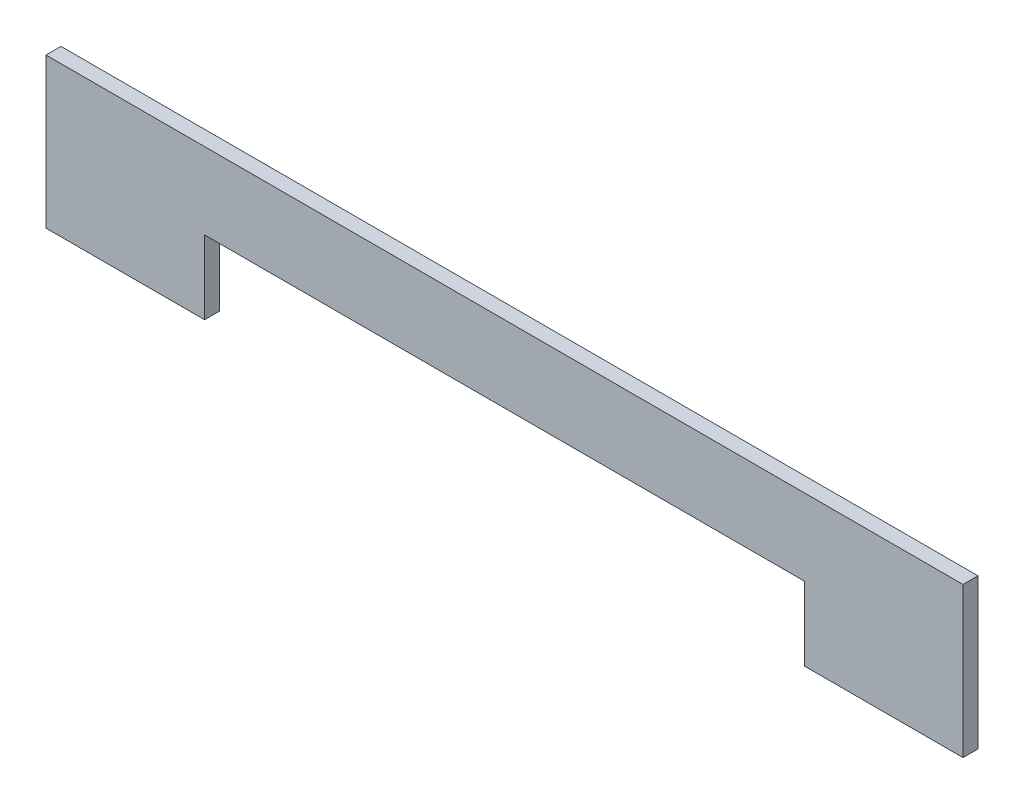
from build123d import *

# Parameters (mm, degrees)
SKETCH_1_W          = 6115
SKETCH_1_H          = 1000
EXTRUDE_1_DEPTH     = 100
SKETCH_2_W          = 4000
SKETCH_2_H          = 490
CUT_EXTRUDE_1_DEPTH = 6198.033564537


with BuildPart() as part:
    # Эскиз1 → Бобышка-Вытянуть1 (new body)
    with BuildSketch(Plane.XY):
        with Locations((3057.5, -500)):
            Rectangle(SKETCH_1_W, SKETCH_1_H)
    extrude(amount=EXTRUDE_1_DEPTH)

    # Эскиз2 → Вырез-Вытянуть1 (cut, through all)
    with BuildSketch(Plane(origin=(0, 0, 0), x_dir=(-1, 0, 0), z_dir=(0, 0, -1))):
        with Locations((-3057.5, -755)):
            Rectangle(SKETCH_2_W, SKETCH_2_H)
    extrude(amount=-CUT_EXTRUDE_1_DEPTH, mode=Mode.SUBTRACT)


solid = part.part
